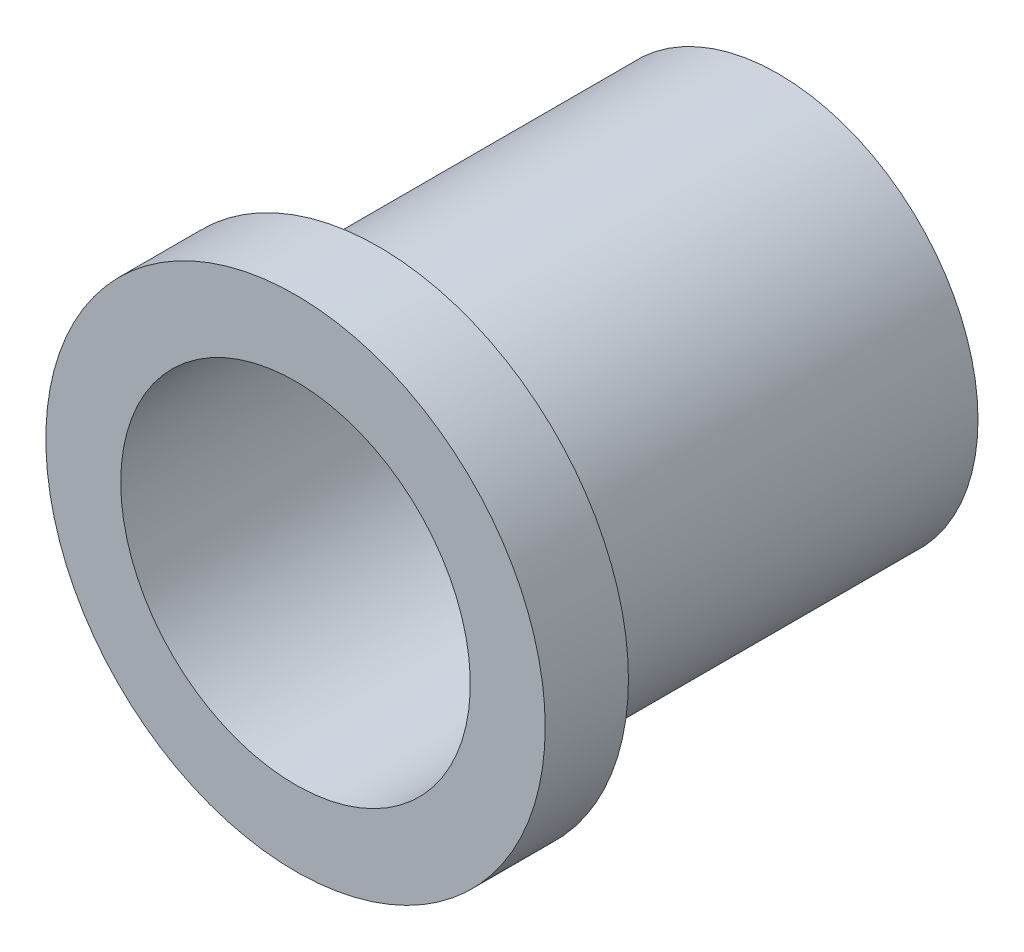
from build123d import *

# Parameters (mm, degrees)
SKETCH1_R           = 12
BOSS_EXTRUDE1_DEPTH = 24
SKETCH2_R           = 15
BOSS_EXTRUDE2_DEPTH = 5
SKETCH3_R           = 10.5
CUT_EXTRUDE2_DEPTH  = 36.930488446


with BuildPart() as part:
    # Sketch1 → Boss-Extrude1 (new body)
    with BuildSketch(Plane.XY):
        Circle(SKETCH1_R)
    extrude(amount=BOSS_EXTRUDE1_DEPTH)

    # Sketch2 → Boss-Extrude2 (add)
    with BuildSketch(Plane.XY.offset(24)):
        Circle(SKETCH2_R)
    extrude(amount=BOSS_EXTRUDE2_DEPTH)

    # Sketch3 → Cut-Extrude2 (cut, through all)
    with BuildSketch(Plane(origin=(0, 0, 0), x_dir=(-1, 0, 0), z_dir=(0, 0, -1))):
        Circle(SKETCH3_R)
    extrude(amount=-CUT_EXTRUDE2_DEPTH, mode=Mode.SUBTRACT)


solid = part.part
